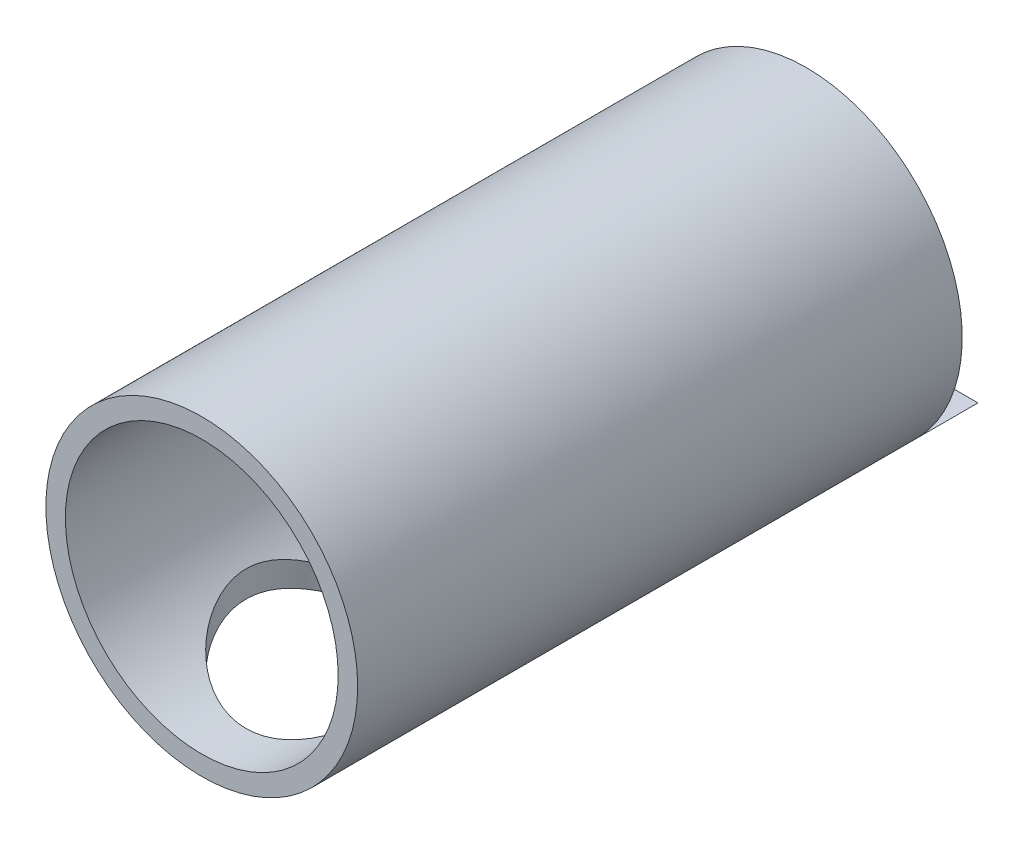
from build123d import *

# Parameters (mm, degrees)
SKETCH1_R               = 25.4
SKETCH1_R_2             = 22.225
BOSS_EXTRUDE1_DEPTH     = 914.4
CUT_EXTRUDE1_START      = -130.175
SKETCH2_R               = 25.4
CUT_EXTRUDE1_DEPTH      = 785.93028356
CUT_EXTRUDE2_DEPTH      = 126.88384527
SKETCH4_W               = 50.8
SKETCH4_H               = 22.14481799
CUT_EXTRUDE3_DEPTH      = 143.025809714
CUT_EXTRUDE4_REACH      = 124.05
CUT_EXTRUDE4_END_RADIUS = 22.225
SKETCH5_R               = 15.875


with BuildPart() as part:
    # Sketch1 → Boss-Extrude1 (new body)
    with BuildSketch(Plane.XY):
        Circle(SKETCH1_R)
        Circle(SKETCH1_R_2, mode=Mode.SUBTRACT)
    extrude(amount=BOSS_EXTRUDE1_DEPTH)

    # Sketch2 → Cut-Extrude1 (cut, through all)
    with BuildSketch(Plane(origin=(0, 0, 0), x_dir=(-1, 0, 0), z_dir=(0, 0, -1)).offset(CUT_EXTRUDE1_START)):
        Circle(SKETCH2_R)
    extrude(amount=-CUT_EXTRUDE1_DEPTH, mode=Mode.SUBTRACT)

    # Sketch3 → Cut-Extrude2 (cut, through all)
    with BuildSketch(Plane(origin=(0, 0, 9.525), x_dir=(-1, 0, 0), z_dir=(0, 0, -1))):
        with BuildLine():
            Line((-18.445083186, -17.4625), (18.445083186, -17.4625))
            ThreePointArc((18.445083186, -17.4625), (0, 25.4), (-18.445083186, -17.4625))
        make_face()
    extrude(amount=CUT_EXTRUDE2_DEPTH, mode=Mode.SUBTRACT)

    # Sketch4 → Cut-Extrude3 (cut, through all)
    with BuildSketch(Plane(origin=(0, 25.4, 0), x_dir=(1, 0, 0), z_dir=(0, 1, 0))):
        with Locations((0, -119.102591005)):
            Rectangle(SKETCH4_W, SKETCH4_H)
    extrude(amount=-CUT_EXTRUDE3_DEPTH, mode=Mode.SUBTRACT)

    # Cut-Extrude4: up to this cylinder (the profile starts outside it)
    cut_extrude4_end = Plane(origin=(0, 0, 84.942471), z_dir=(0, 0, -1)) * Cylinder(CUT_EXTRUDE4_END_RADIUS, 293.55, mode=Mode.PRIVATE)
    # Sketch5 → Cut-Extrude4 (cut, up to the surface)
    with BuildSketch(Plane(origin=(0, -25.4, 0), x_dir=(-1, 0, 0), z_dir=(0, -1, 0)), mode=Mode.PRIVATE) as cut_extrude4_sk1:
        with Locations(Location((0, -84.94247095, 0), (0, 0, 90))):
            Circle(SKETCH5_R)
    cut_extrude4_tool1 = extrude(cut_extrude4_sk1.sketch, amount=-CUT_EXTRUDE4_REACH, mode=Mode.PRIVATE) - cut_extrude4_end
    add(cut_extrude4_tool1.solids().sort_by_distance((0, -25.4, 84.942471))[0], mode=Mode.SUBTRACT)


solid = part.part
